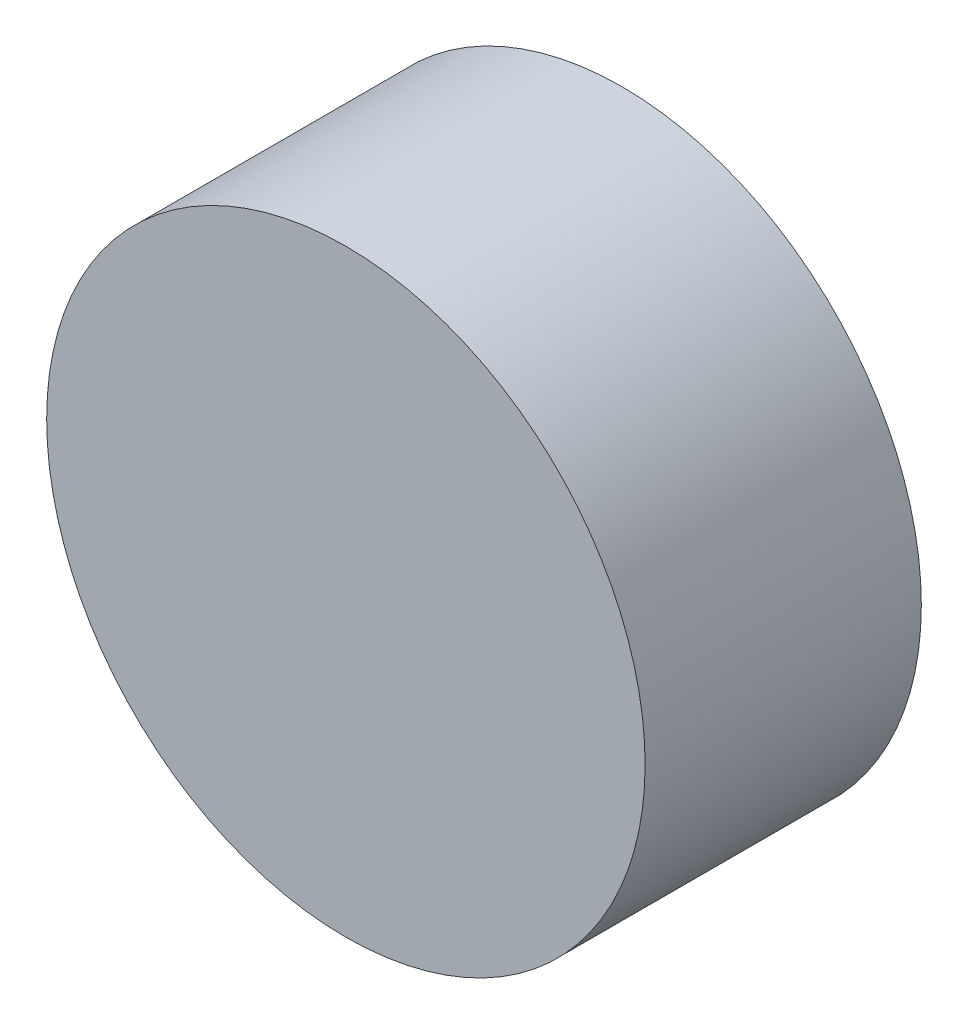
from build123d import *

# Parameters (mm, degrees)
SKETCH_1_R      = 65
EXTRUDE_1_DEPTH = 60


with BuildPart() as part:
    # 草图1 → 凸台-拉伸1 (new body)
    with BuildSketch(Plane.XY):
        Circle(SKETCH_1_R)
    extrude(amount=EXTRUDE_1_DEPTH)


solid = part.part
